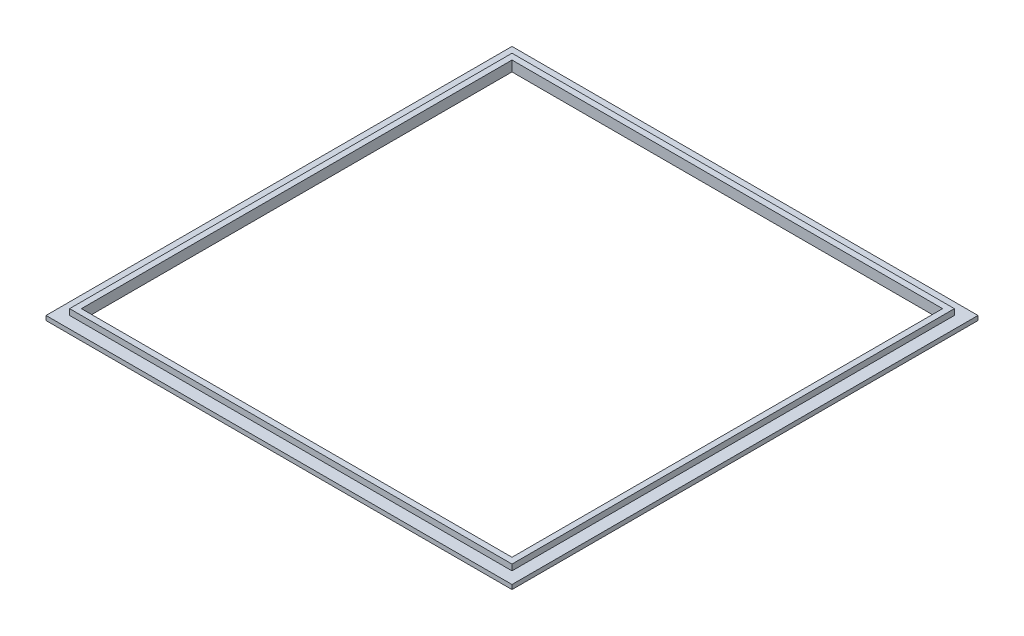
from build123d import *

# Parameters (mm, degrees)
CROQUIS1_W              = 158
CROQUIS1_H              = 158
CROQUIS1_W_2            = 146
CROQUIS1_H_2            = 146
SALIENTE_EXTRUIR1_DEPTH = 1.5
CROQUIS2_W              = 150
CROQUIS2_H              = 150
CROQUIS2_W_2            = 146
CROQUIS2_H_2            = 146
SALIENTE_EXTRUIR2_DEPTH = 2


with BuildPart() as part:
    # Croquis1 → Saliente-Extruir1 (new body)
    with BuildSketch(Plane(origin=(0, 0, 0), x_dir=(1, 0, 0), z_dir=(0, 1, 0))):
        with Locations((73, 73)):
            Rectangle(CROQUIS1_W, CROQUIS1_H)
        with Locations((73, 73)):
            Rectangle(CROQUIS1_W_2, CROQUIS1_H_2, mode=Mode.SUBTRACT)
    extrude(amount=SALIENTE_EXTRUIR1_DEPTH)

    # Croquis2 → Saliente-Extruir2 (add)
    with BuildSketch(Plane(origin=(0, 1.5, 0), x_dir=(1, 0, 0), z_dir=(0, 1, 0))):
        with Locations((73, 73)):
            Rectangle(CROQUIS2_W, CROQUIS2_H)
        with Locations((73, 73)):
            Rectangle(CROQUIS2_W_2, CROQUIS2_H_2, mode=Mode.SUBTRACT)
    extrude(amount=SALIENTE_EXTRUIR2_DEPTH)


solid = part.part
